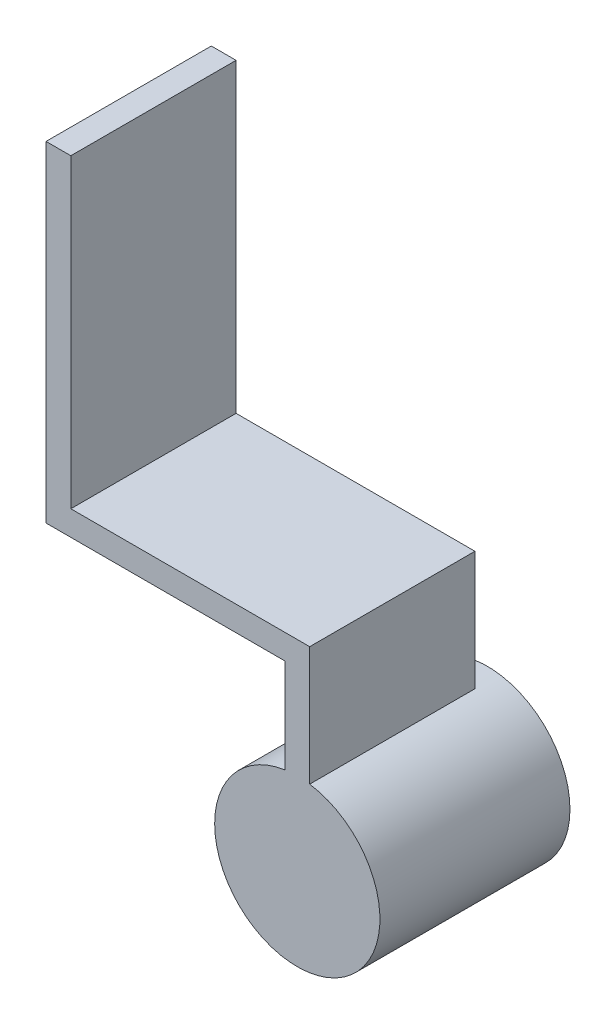
from build123d import *

# Parameters (mm, degrees)
BOSS_EXTRUDE1_DEPTH = 20
BOSS_EXTRUDE2_START = -20
SKETCH4_R           = 10
BOSS_EXTRUDE2_DEPTH = 23


with BuildPart() as part:
    # Sketch1 → Boss-Extrude1 (new body)
    with BuildSketch(Plane.XY):
        Polygon((0, 0), (0, -27.999047944), (-3, -27.999047944), (-3, -2.999047944), (-31.907622925, -2.999047944), (-31.907622925, 37.000952056), (-28.907622925, 37.000952056), (-28.907622925, 0), align=None)
    extrude(amount=BOSS_EXTRUDE1_DEPTH)

    # Sketch4 → Boss-Extrude2 (add)
    with BuildSketch(Plane(origin=(0, 0, 0), x_dir=(-1, 0, 0), z_dir=(0, 0, -1)).offset(BOSS_EXTRUDE2_START)):
        with Locations((1.5, -24.299047944)):
            Circle(SKETCH4_R)
    extrude(amount=BOSS_EXTRUDE2_DEPTH)


solid = part.part
